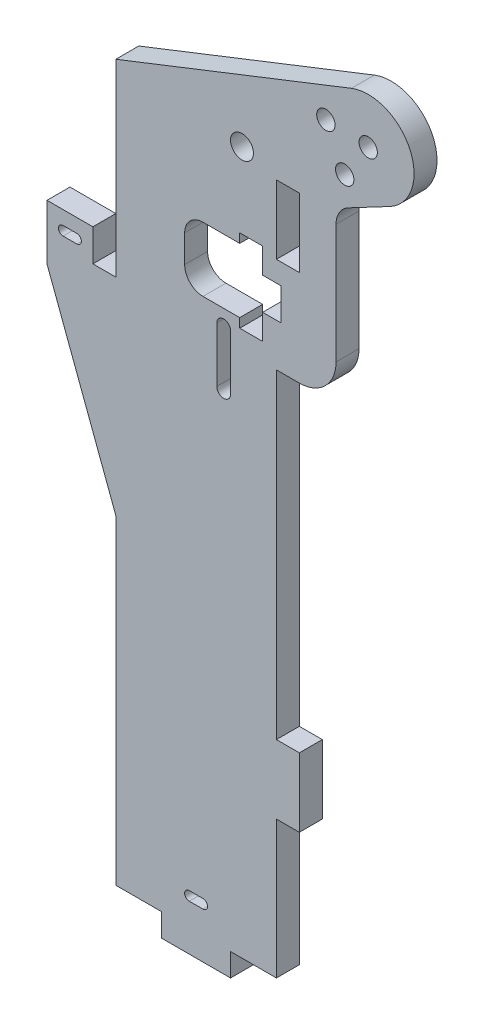
from build123d import *

# Parameters (mm, degrees)
SKETCH2_R           = 2
BOSS_EXTRUDE1_DEPTH = 5
SKETCH3_R           = 2.5
CUT_EXTRUDE1_DEPTH  = 181.287193762
BOSS_EXTRUDE2_DEPTH = 5
FILLET1_R           = 5
CUT_EXTRUDE2_DEPTH  = 184.789205979
SKETCH6_W           = 5
SKETCH6_H           = 15
CUT_EXTRUDE3_DEPTH  = 184.789205979
FILLET2_R           = 4


with BuildPart() as part:
    # Sketch2 → Boss-Extrude1 (new body)
    with BuildSketch(Plane.XY):
        with BuildLine():
            Line((16.34105486, 176.093079286), (-35, 155.907958626))
            Line((-35, 155.907958626), (-35, 0))
            Line((-35, 0), (-25, 0))
            Line((-25, 0), (-25, -5))
            Line((-25, -5), (-10, -5))
            Line((-10, -5), (-10, 0))
            Line((-10, 0), (0, 0))
            Line((0, 0), (0, 30))
            Line((0, 30), (5, 30))
            Line((5, 30), (5, 45))
            Line((5, 45), (0, 45))
            Line((0, 45), (0, 114.786515986))
            Line((0, 114.786515986), (5, 114.786515986))
            ThreePointArc((5, 114.786515986), (10.656854249, 117.129661736), (13, 122.786515986))
            Line((13, 122.786515986), (13, 151.786515986))
            Line((13, 151.786515986), (24.666554357, 157.942123953))
            ThreePointArc((24.666554357, 157.942123953), (29.089450696, 170.955674898), (16.34105486, 176.093079286))
        make_face()
        with Locations((20, 166.786515986)):
            Circle(SKETCH2_R, mode=Mode.SUBTRACT)
        with Locations((10.78085199, 167.370162539)):
            Circle(SKETCH2_R, mode=Mode.SUBTRACT)
        with Locations((14.884973253, 159.094322884)):
            Circle(SKETCH2_R, mode=Mode.SUBTRACT)
    extrude(amount=BOSS_EXTRUDE1_DEPTH)

    # Sketch3 → Cut-Extrude1 (cut, through all)
    with BuildSketch(Plane.XY.offset(5)):
        with Locations((-7.5, 153.1488261)):
            Circle(SKETCH3_R)
        Polygon((-3, 136.647544915), (-3, 131.147544915), (1, 131.147544915), (1, 124.147544915), (-3, 124.147544915), (-3, 118.647544915), (-8, 118.647544915), (-8, 120.647544915), (-20, 120.647544915), (-20, 134.647544915), (-8, 134.647544915), (-8, 136.647544915), align=None)
    extrude(amount=-CUT_EXTRUDE1_DEPTH, mode=Mode.SUBTRACT)

    # Sketch4 → Boss-Extrude2 (add)
    with BuildSketch(Plane(origin=(0, 0, 0), x_dir=(-1, 0, 0), z_dir=(0, 0, -1))):
        Polygon((40, 114.786515986), (35, 114.786515986), (35, 69.786515986), (50, 109.786515986), (50, 121.786515986), (40, 121.786515986), align=None)
    extrude(amount=-BOSS_EXTRUDE2_DEPTH)

    # Fillet1
    fillet1_edges = [part.edges().sort_by_distance(p)[0] for p in [
        (13, 151.786515986, 2.5),
    ]]
    fillet(fillet1_edges, radius=FILLET1_R)

    # Sketch5 → Cut-Extrude2 (cut, through all)
    with BuildSketch(Plane.XY.offset(5)):
        with BuildLine():
            Line((-10, 117.147544915), (-10, 105.147544915))
            ThreePointArc((-10, 105.147544915), (-11.5, 103.647544915), (-13, 105.147544915))
            Line((-13, 105.147544915), (-13, 117.147544915))
            ThreePointArc((-13, 117.147544915), (-11.5, 118.647544915), (-10, 117.147544915))
        make_face()
        with BuildLine():
            Line((-43.5, 116.786515986), (-46.5, 116.786515986))
            ThreePointArc((-46.5, 116.786515986), (-47.5, 117.786515986), (-46.5, 118.786515986))
            Line((-46.5, 118.786515986), (-43.5, 118.786515986))
            ThreePointArc((-43.5, 118.786515986), (-42.5, 117.786515986), (-43.5, 116.786515986))
        make_face()
        with BuildLine():
            Line((-19, 7), (-16, 7))
            ThreePointArc((-16, 7), (-15, 6), (-16, 5))
            Line((-16, 5), (-19, 5))
            ThreePointArc((-19, 5), (-20, 6), (-19, 7))
        make_face()
    extrude(amount=-CUT_EXTRUDE2_DEPTH, mode=Mode.SUBTRACT)

    # Sketch6 → Cut-Extrude3 (cut, through all)
    with BuildSketch(Plane(origin=(0, 0, 0), x_dir=(-1, 0, 0), z_dir=(0, 0, -1))):
        with Locations((-2.5, 143.148799484)):
            Rectangle(SKETCH6_W, SKETCH6_H)
    extrude(amount=-CUT_EXTRUDE3_DEPTH, mode=Mode.SUBTRACT)

    # Fillet2
    fillet2_edges = [part.edges().sort_by_distance(p)[0] for p in [
        (-20, 134.647544915, 2.5),
        (-20, 120.647544915, 2.5),
    ]]
    fillet(fillet2_edges, radius=FILLET2_R)


solid = part.part
